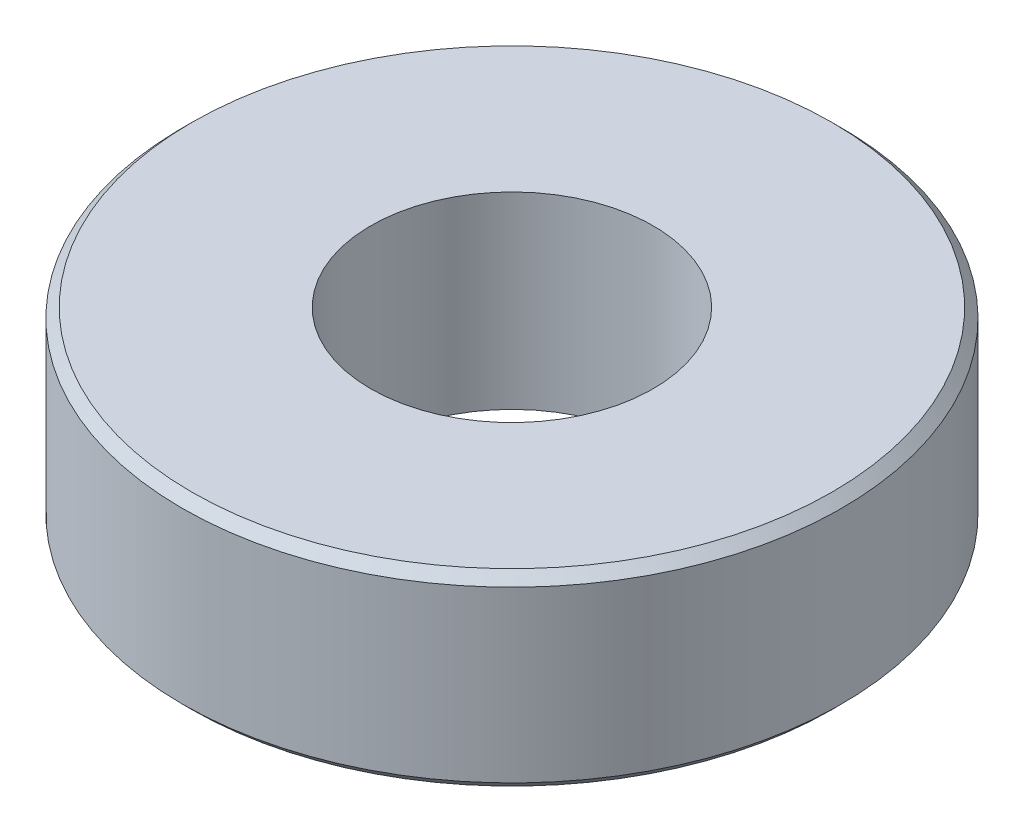
from build123d import *

# Parameters (mm, degrees)
SKETCH_1_R      = 7
SKETCH_1_R_2    = 3
EXTRUDE_1_DEPTH = 4
CHAMFER_1_SIZE  = 0.2


with BuildPart() as part:
    # 草图1 → 凸台-拉伸1 (new body)
    with BuildSketch(Plane(origin=(0, 0, 0), x_dir=(1, 0, 0), z_dir=(0, 1, 0))):
        with Locations(Location((0, 0, 0), (0, 0, 270))):
            Circle(SKETCH_1_R)
        with Locations(Location((0, 0, 0), (0, 0, 270))):
            Circle(SKETCH_1_R_2, mode=Mode.SUBTRACT)
    extrude(amount=EXTRUDE_1_DEPTH)

    # 倒角1
    chamfer_1_edges = [part.edges().sort_by_distance(p)[0] for p in [
        (0, 0, -7),
        (0, 4, -7),
    ]]
    chamfer(chamfer_1_edges, length=CHAMFER_1_SIZE)


solid = part.part
